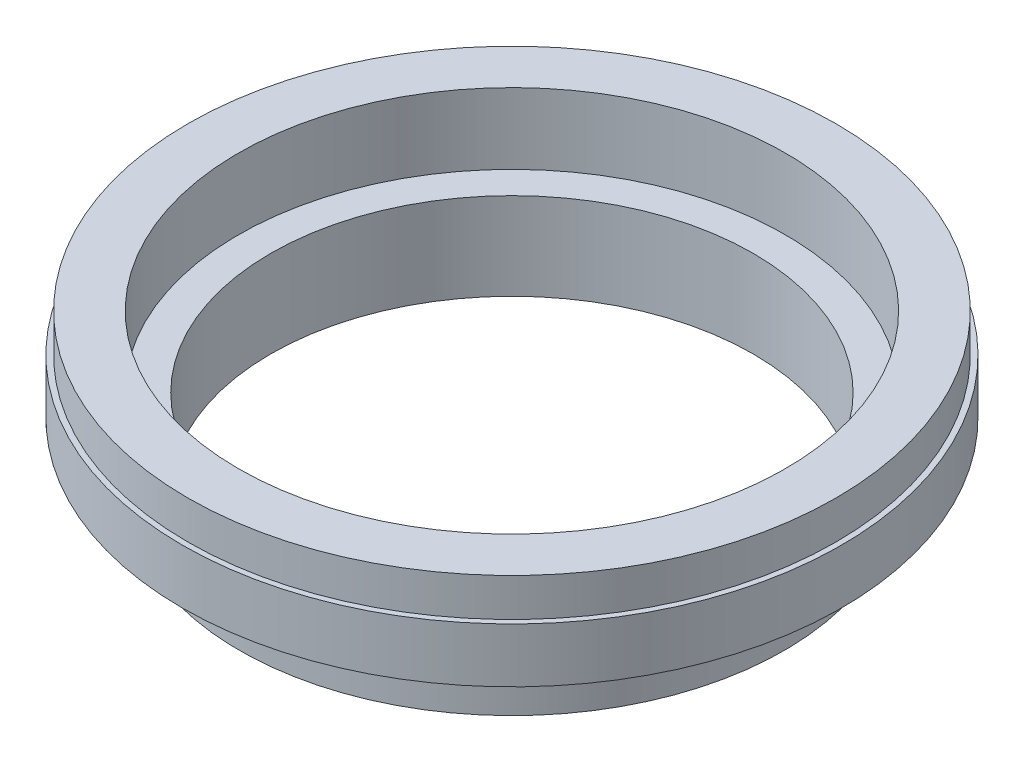
from build123d import *

# Parameters (mm, degrees)
SKETCH1_R           = 12.7
SKETCH1_R_2         = 11.25
BOSS_EXTRUDE1_DEPTH = 3.048
SKETCH2_R           = 15.367
BOSS_EXTRUDE2_DEPTH = 2.54
SKETCH3_R           = 15.113
BOSS_EXTRUDE3_DEPTH = 1.778
SKETCH4_R           = 11.25
CUT_EXTRUDE1_DEPTH  = 4.318
SKETCH5_R           = 12.75
CUT_EXTRUDE2_DEPTH  = 3.302


with BuildPart() as part:
    # Sketch1 → Boss-Extrude1 (new body)
    with BuildSketch(Plane(origin=(0, 0, 0), x_dir=(1, 0, 0), z_dir=(0, 1, 0))):
        with Locations(Location((0, 0, 0), (0, 0, 90))):
            Circle(SKETCH1_R)
        with Locations(Location((0, 0, 0), (0, 0, 90))):
            Circle(SKETCH1_R_2, mode=Mode.SUBTRACT)
    extrude(amount=BOSS_EXTRUDE1_DEPTH)

    # Sketch2 → Boss-Extrude2 (add)
    with BuildSketch(Plane(origin=(0, 3.048, 0), x_dir=(1, 0, 0), z_dir=(0, 1, 0))):
        with Locations(Location((0, 0, 0), (0, 0, 270))):
            Circle(SKETCH2_R)
    extrude(amount=BOSS_EXTRUDE2_DEPTH)

    # Sketch3 → Boss-Extrude3 (add)
    with BuildSketch(Plane(origin=(0, 5.588, 0), x_dir=(1, 0, 0), z_dir=(0, 1, 0))):
        with Locations(Location((0, 0, 0), (0, 0, 270))):
            Circle(SKETCH3_R)
    extrude(amount=BOSS_EXTRUDE3_DEPTH)

    # Sketch4 → Cut-Extrude1 (cut)
    with BuildSketch(Plane.XZ.offset(-3.048)):
        with Locations(Location((0, 0, 0), (0, 0, 270))):
            Circle(SKETCH4_R)
    extrude(amount=-CUT_EXTRUDE1_DEPTH, mode=Mode.SUBTRACT)

    # Sketch5 → Cut-Extrude2 (cut)
    with BuildSketch(Plane(origin=(0, 7.366, 0), x_dir=(1, 0, 0), z_dir=(0, 1, 0))):
        with Locations(Location((0, 0, 0), (0, 0, 270))):
            Circle(SKETCH5_R)
    extrude(amount=-CUT_EXTRUDE2_DEPTH, mode=Mode.SUBTRACT)


solid = part.part
